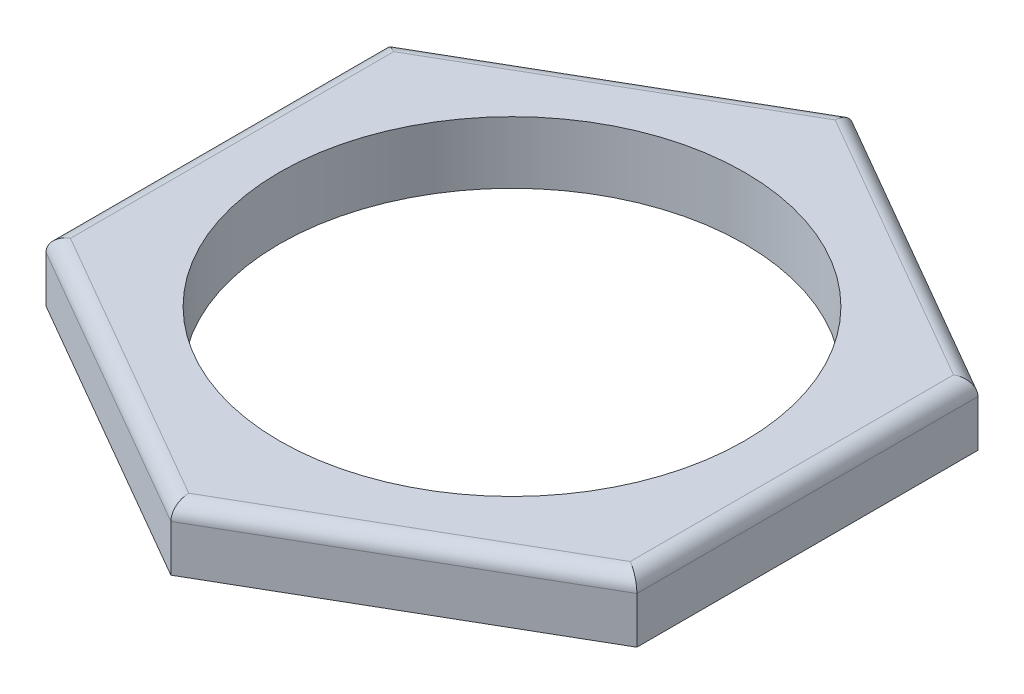
from build123d import *

# Parameters (mm, degrees)
SKETCH1_R           = 7.5
BOSS_EXTRUDE1_DEPTH = 2
FILLET1_R           = 0.5


with BuildPart() as part:
    # Sketch1 → Boss-Extrude1 (new body)
    with BuildSketch(Plane(origin=(0, 0, 0), x_dir=(1, 0, 0), z_dir=(0, 1, 0))):
        Polygon((0, 11), (9.526279442, 5.5), (9.526279442, -5.5), (0, -11), (-9.526279442, -5.5), (-9.526279442, 5.5), align=None)
        with Locations(Location((0, 0, 0), (0, 0, 270))):
            Circle(SKETCH1_R, mode=Mode.SUBTRACT)
    extrude(amount=BOSS_EXTRUDE1_DEPTH)

    # Fillet1
    fillet1_edges = [part.edges().sort_by_distance(p)[0] for p in [
        (-4.763139721, 2, 8.25),
        (4.763139721, 2, 8.25),
        (9.526279442, 2, 0),
        (4.763139721, 2, -8.25),
        (-4.763139721, 2, -8.25),
        (-9.526279442, 2, 0),
    ]]
    fillet(fillet1_edges, radius=FILLET1_R)


solid = part.part
